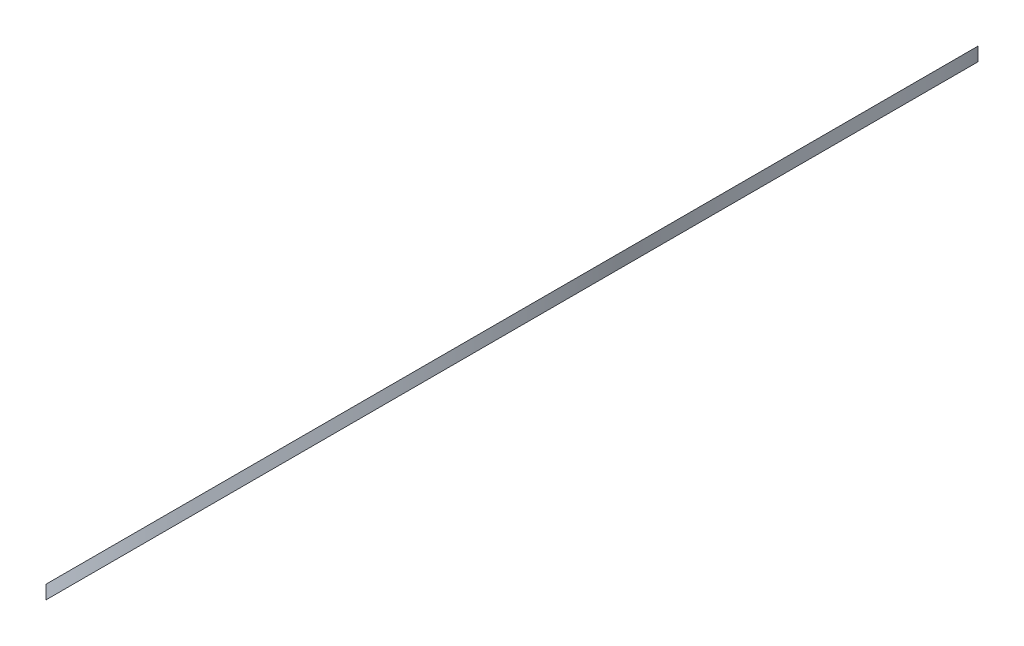
from build123d import *

# Parameters (mm, degrees)
SKETCH4_W               = 232.52141371
SKETCH4_H               = 186.000175814
BOSS_EXTRUDE1_DEPTH     = 1
SKETCH1_OUTSIDE_W       = 226.832
SKETCH1_OUTSIDE_H       = 247.708
SKETCH1_OUTSIDE_R       = 35.5
CUT_EXTRUDE2_DEPTH      = 185.225637078
CUT_EXTRUDE3_DEPTH      = 109.319901238
CUT_EXTRUDE3_DEPTH_BACK = 109.319901238
SKETCH5_R               = 62.5


with BuildPart() as part:
    # Sketch4 → Boss-Extrude1 (new body)
    with BuildSketch(Plane(origin=(-30.241408096, 30.241408096, 0), x_dir=(0.7071067811865512, 0.7071067811865439, 0), z_dir=(0.7071067811865439, -0.7071067811865512, 0))):
        Rectangle(SKETCH4_W, SKETCH4_H)
    extrude(amount=BOSS_EXTRUDE1_DEPTH)

    # Sketch1 outside → Cut-Extrude2 (cut, through all)
    with BuildSketch(Plane(origin=(0, 0, 0), x_dir=(1, 0, 0), z_dir=(0, 1, 0))):
        with Locations((-29.888, 0)):
            Rectangle(SKETCH1_OUTSIDE_W, SKETCH1_OUTSIDE_H)
        with Locations(Location((0, 0, 0), (0, 0, 180))):
            Circle(SKETCH1_OUTSIDE_R, mode=Mode.SUBTRACT)
    extrude(amount=CUT_EXTRUDE2_DEPTH, mode=Mode.SUBTRACT)


with BuildPart() as body_2:
    # of the pieces the cut leaves, the one that is kept (cut_extrude2_keep)
    add(part.part.solids().sort_by_distance((-35.5, 24.982816193, 0))[0])

    # Sketch5 → Cut-Extrude3 (cut, two sides: drawn at the far end of the back side and taken through both)
    with BuildSketch(Plane(origin=(0, 0, 0), x_dir=(1, 0, 0), z_dir=(0, 1, 0)).offset(-CUT_EXTRUDE3_DEPTH_BACK)):
        with Locations((-67.416033427, 0)):
            Circle(SKETCH5_R)
    extrude(amount=CUT_EXTRUDE3_DEPTH + CUT_EXTRUDE3_DEPTH_BACK, mode=Mode.SUBTRACT)


solid = body_2.part
